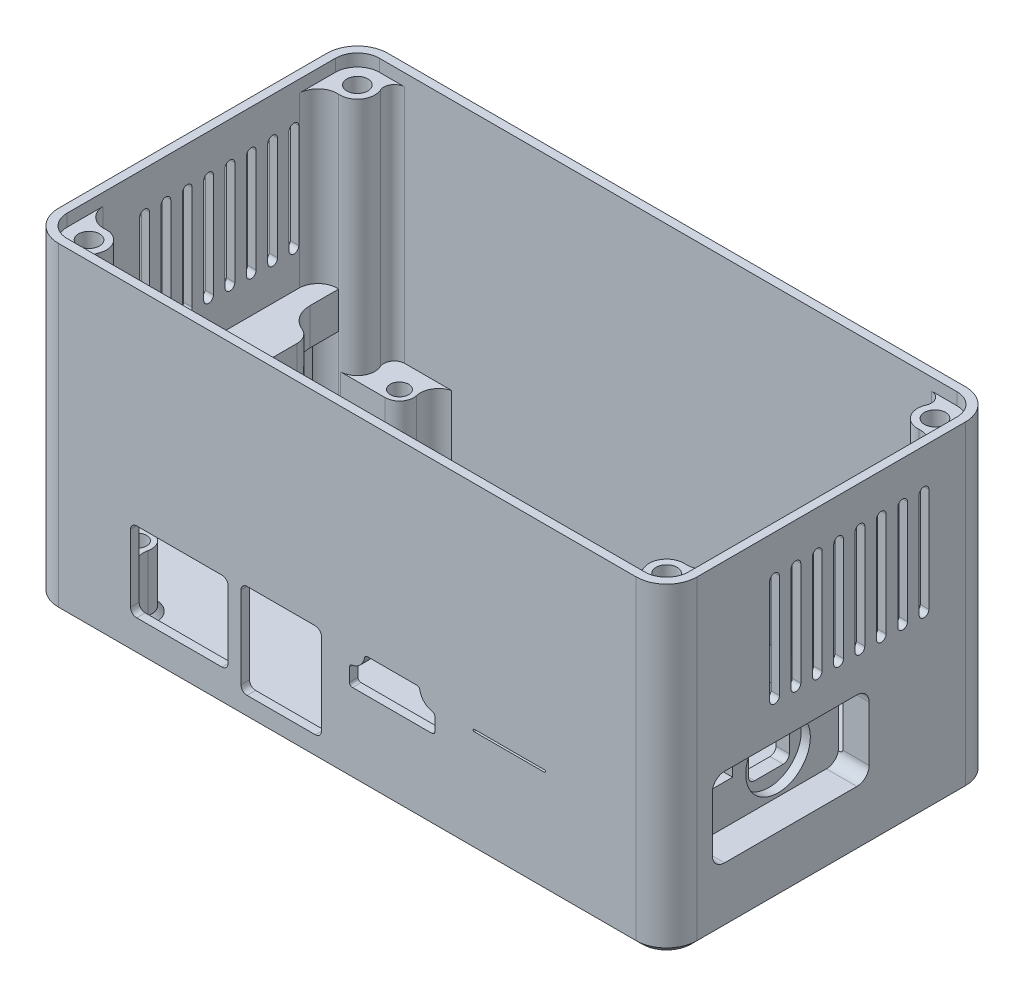
from build123d import *

# Parameters (mm, degrees)
EXTRUDE_1_DEPTH          = 52.66
SHELL_1_T                = -1.4
SKETCH_2_R               = 1.723706828
EXTRUDE_2_DEPTH          = 49.26
MIRROR_2_COPY_1_SKETCH_R = 1.723706828
MIRROR_2_COPY_1_DEPTH    = 49.26
SKETCH_3_R               = 1.5
EXTRUDE_3_DEPTH          = 10
EXTRUDE_4_DEPTH          = 21.6
CUT_EXTRUDE_1_DEPTH      = 15.6
CHAMFER_1_SIZE           = 1
CUT_EXTRUDE_2_DEPTH      = 5
SKETCH_7_R               = 5.3
CUT_EXTRUDE_3_DEPTH      = 1.5
CUT_EXTRUDE_4_DEPTH      = 22
CUT_EXTRUDE_5_REACH      = 93.813
CUT_EXTRUDE_6_REACH      = 122.267
SKETCH_11_R              = 1.723706828
CUT_EXTRUDE_7_DEPTH      = 34
SKETCH_13_R              = 1.5
CUT_EXTRUDE_8_DEPTH      = 10
CHAMFER_2_SIZE           = 3


with BuildPart() as part:
    # 草图1 → 凸台-拉伸1 (new body)
    with BuildSketch(Plane(origin=(0, 0, 0), x_dir=(1, 0, 0), z_dir=(0, 1, 0))):
        with BuildLine():
            Line((47.35, -27), (-47.35, -27))
            ThreePointArc((-47.35, -27), (-50.885533906, -25.535533906), (-52.35, -22))
            Line((-52.35, -22), (-52.35, 22))
            ThreePointArc((-52.35, 22), (-50.885533906, 25.535533906), (-47.35, 27))
            Line((-47.35, 27), (47.35, 27))
            ThreePointArc((47.35, 27), (50.885533906, 25.535533906), (52.35, 22))
            Line((52.35, 22), (52.35, -22))
            ThreePointArc((52.35, -22), (50.885533906, -25.535533906), (47.35, -27))
        make_face()
    extrude(amount=EXTRUDE_1_DEPTH)

    # 抽壳1
    shell_1_openings = [part.faces().sort_by_distance(p)[0] for p in [
        (0, 52.66, 0),
    ]]
    offset(amount=SHELL_1_T, openings=shell_1_openings, kind=Kind.INTERSECTION)

    # 草图2 → 凸台-拉伸2 (add)
    with BuildSketch(Plane(origin=(0, 1.4, 0), x_dir=(1, 0, 0), z_dir=(0, 1, 0))):
        with BuildLine():
            ThreePointArc((-44.739177083, 23.164131527), (-44.61889724, 24.798058128), (-43.190236115, 25.6))
            Line((-43.190236115, 25.6), (-47.35, 25.6))
            ThreePointArc((-47.35, 25.6), (-49.895584412, 24.545584412), (-50.95, 22))
            Line((-50.95, 22), (-50.95, 16.121983226))
            ThreePointArc((-50.95, 16.121983226), (-49.897898243, 18.354900791), (-47.560815859, 19.149183417))
            ThreePointArc((-47.560815859, 19.149183417), (-45.011205321, 20.356333986), (-44.739177083, 23.164131527))
        make_face()
        with Locations(Location((-47.35, 22, 0), (0, 0, 90))):
            Circle(SKETCH_2_R, mode=Mode.SUBTRACT)
    extrude_2 = extrude(amount=EXTRUDE_2_DEPTH)

    # 镜向1: 凸台-拉伸2 across plane
    add(extrude_2.mirror(Plane(origin=(0, 0, 0), x_dir=(0, 0, 1), z_dir=(1, 0, 0))))

    # 镜向2: 凸台-拉伸2 across plane
    add(extrude_2.mirror(Plane.XY))

    # 镜向2 copy 1 sketch → 镜向2 copy 1 (add)
    with BuildSketch(Plane(origin=(0, 1.4, 0), x_dir=(-1, 0, 0), z_dir=(0, 1, 0))):
        with BuildLine():
            ThreePointArc((-44.739177083, 23.164131527), (-44.61889724, 24.798058128), (-43.190236115, 25.6))
            Line((-43.190236115, 25.6), (-47.35, 25.6))
            ThreePointArc((-47.35, 25.6), (-49.895584412, 24.545584412), (-50.95, 22))
            Line((-50.95, 22), (-50.95, 16.121983226))
            ThreePointArc((-50.95, 16.121983226), (-49.897898243, 18.354900791), (-47.560815859, 19.149183417))
            ThreePointArc((-47.560815859, 19.149183417), (-45.011205321, 20.356333986), (-44.739177083, 23.164131527))
        make_face()
        with Locations(Location((-47.35, 22, 0), (0, 0, 90))):
            Circle(MIRROR_2_COPY_1_SKETCH_R, mode=Mode.SUBTRACT)
    extrude(amount=MIRROR_2_COPY_1_DEPTH)

    # 草图3 → 凸台-拉伸3 (add)
    # profile 1 of 4: a face of its own
    with BuildSketch(Plane(origin=(0, 1.4, 0), x_dir=(1, 0, 0), z_dir=(0, 1, 0))):
        with BuildLine():
            ThreePointArc((-44.739177083, 23.164131527), (-44.937413463, 20.466694839), (-47.29547034, 19.141919345))
            Line((-47.29547034, 19.141919345), (-39.925, 19.141919345))
            ThreePointArc((-39.925, 19.141919345), (-38.097072242, 20.025191235), (-37.653200541, 22.006217999))
            ThreePointArc((-37.653200541, 22.006217999), (-37.298713844, 24.245427783), (-35.480787721, 25.6))
            Line((-35.480787721, 25.6), (-43.190236115, 25.6))
            ThreePointArc((-43.190236115, 25.6), (-44.61889724, 24.798058128), (-44.739177083, 23.164131527))
        make_face()
        with Locations(Location((-39.925, 21.475, 0), (0, 0, 270))):
            Circle(SKETCH_3_R, mode=Mode.SUBTRACT)
    # profile 2 of 4: a face of its own
    with BuildSketch(Plane(origin=(0, 1.4, 0), x_dir=(1, 0, 0), z_dir=(0, 1, 0))):
        with BuildLine():
            Line((-43.190236115, -25.6), (-35.480787721, -25.6))
            ThreePointArc((-35.480787721, -25.6), (-37.298713844, -24.245427783), (-37.653200541, -22.006217999))
            ThreePointArc((-37.653200541, -22.006217999), (-38.097072242, -20.025191235), (-39.925, -19.141919345))
            Line((-39.925, -19.141919345), (-47.29547034, -19.141919345))
            ThreePointArc((-47.29547034, -19.141919345), (-44.937413463, -20.466694839), (-44.739177083, -23.164131527))
            ThreePointArc((-44.739177083, -23.164131527), (-44.61889724, -24.798058128), (-43.190236115, -25.6))
        make_face()
        with Locations(Location((-39.925, -21.475, 0), (0, 0, 90))):
            Circle(SKETCH_3_R, mode=Mode.SUBTRACT)
    # profile 3 of 4: a face of its own
    with BuildSketch(Plane(origin=(0, 1.4, 0), x_dir=(1, 0, 0), z_dir=(0, 1, 0))):
        with BuildLine():
            Line((43.190236115, 25.6), (35.480787721, 25.6))
            ThreePointArc((35.480787721, 25.6), (37.298713844, 24.245427783), (37.653200541, 22.006217999))
            ThreePointArc((37.653200541, 22.006217999), (38.097072242, 20.025191235), (39.925, 19.141919345))
            Line((39.925, 19.141919345), (47.29547034, 19.141919345))
            ThreePointArc((47.29547034, 19.141919345), (44.937413463, 20.466694839), (44.739177083, 23.164131527))
            ThreePointArc((44.739177083, 23.164131527), (44.61889724, 24.798058128), (43.190236115, 25.6))
        make_face()
        with Locations(Location((39.925, 21.475, 0), (0, 0, 90))):
            Circle(SKETCH_3_R, mode=Mode.SUBTRACT)
    # profile 4 of 4: a face of its own
    with BuildSketch(Plane(origin=(0, 1.4, 0), x_dir=(1, 0, 0), z_dir=(0, 1, 0))):
        with BuildLine():
            ThreePointArc((44.739177083, -23.164131527), (44.937413463, -20.466694839), (47.29547034, -19.141919345))
            Line((47.29547034, -19.141919345), (39.925, -19.141919345))
            ThreePointArc((39.925, -19.141919345), (38.097072242, -20.025191235), (37.653200541, -22.006217999))
            ThreePointArc((37.653200541, -22.006217999), (37.298713844, -24.245427783), (35.480787721, -25.6))
            Line((35.480787721, -25.6), (43.190236115, -25.6))
            ThreePointArc((43.190236115, -25.6), (44.61889724, -24.798058128), (44.739177083, -23.164131527))
        make_face()
        with Locations(Location((39.925, -21.475, 0), (0, 0, 270))):
            Circle(SKETCH_3_R, mode=Mode.SUBTRACT)
    extrude(amount=EXTRUDE_3_DEPTH)

    # 草图4 → 凸台-拉伸4 (add)
    with BuildSketch(Plane(origin=(0, 1.4, 0), x_dir=(1, 0, 0), z_dir=(0, 1, 0))):
        with BuildLine():
            Line((-47.560815859, 14.421543146), (-47.560815859, 19.149183417))
            ThreePointArc((-47.560815859, 19.149183417), (-49.897898243, 18.354900791), (-50.95, 16.121983226))
            Line((-50.95, 16.121983226), (-50.95, -16.121983226))
            ThreePointArc((-50.95, -16.121983226), (-49.897898243, -18.354900791), (-47.560815859, -19.149183417))
            Line((-47.560815859, -19.149183417), (-47.560815859, -14.421543146))
            ThreePointArc((-47.560815859, -14.421543146), (-46.829898439, -12.029945531), (-44.886897894, -10.45554777))
            ThreePointArc((-44.886897894, -10.45554777), (-43.69744723, -9.491745435), (-43.25, -8.027676174))
            Line((-43.25, -8.027676174), (-43.25, 8.027676174))
            ThreePointArc((-43.25, 8.027676174), (-43.69744723, 9.491745435), (-44.886897894, 10.45554777))
            ThreePointArc((-44.886897894, 10.45554777), (-46.829898439, 12.029945531), (-47.560815859, 14.421543146))
        make_face()
        with BuildLine():
            Line((43.68, 3.500946468), (43.68, -7.623621855))
            ThreePointArc((43.68, -7.623621855), (44.026150119, -8.806383516), (44.955363777, -9.61589388))
            ThreePointArc((44.955363777, -9.61589388), (45.624500178, -10.198830698), (45.873766473, -11.050549649))
            Line((45.873766473, -11.050549649), (45.873766473, -19.141919345))
            Line((45.873766473, -19.141919345), (47.29547034, -19.141919345))
            ThreePointArc((47.29547034, -19.141919345), (47.428227461, -19.142469776), (47.560815859, -19.149183417))
            ThreePointArc((47.560815859, -19.149183417), (49.897898243, -18.354900791), (50.95, -16.121983226))
            Line((50.95, -16.121983226), (50.95, 9.624721853))
            ThreePointArc((50.95, 9.624721853), (49.715635521, 6.971055127), (46.8908207, 6.205533093))
            ThreePointArc((46.8908207, 6.205533093), (44.656385305, 5.600003303), (43.68, 3.500946468))
        make_face()
    extrude(amount=EXTRUDE_4_DEPTH)

    # 草图5 → 切除-拉伸1 (cut)
    with BuildSketch(Plane(origin=(0, 1.4, 0), x_dir=(1, 0, 0), z_dir=(0, 1, 0))):
        with BuildLine():
            Line((-50.45, 17.708343317), (-50.45, -17.708343317))
            ThreePointArc((-50.45, -17.708343317), (-49.203403602, -18.825785879), (-47.560815859, -19.149183417))
            Line((-47.560815859, -19.149183417), (-47.560815859, -14.421543146))
            ThreePointArc((-47.560815859, -14.421543146), (-46.829898439, -12.029945531), (-44.886897894, -10.45554777))
            ThreePointArc((-44.886897894, -10.45554777), (-43.69744723, -9.491745435), (-43.25, -8.027676174))
            Line((-43.25, -8.027676174), (-43.25, 8.027676174))
            ThreePointArc((-43.25, 8.027676174), (-43.69744723, 9.491745435), (-44.886897894, 10.45554777))
            ThreePointArc((-44.886897894, 10.45554777), (-46.829898439, 12.029945531), (-47.560815859, 14.421543146))
            Line((-47.560815859, 14.421543146), (-47.560815859, 19.149183417))
            ThreePointArc((-47.560815859, 19.149183417), (-49.203403602, 18.825785879), (-50.45, 17.708343317))
        make_face()
    extrude(amount=CUT_EXTRUDE_1_DEPTH, mode=Mode.SUBTRACT)

    # 倒角1
    chamfer_1_edges = [part.edges().sort_by_distance(p)[0] for p in [
        (0, 0, -27),
        (50.885533906, 0, -25.535533906),
        (52.35, 0, 0),
        (50.885533906, 0, 25.535533906),
        (0, 0, 27),
        (-50.885533906, 0, 25.535533906),
        (-52.35, 0, 0),
        (-50.885533906, 0, -25.535533906),
    ]]
    chamfer(chamfer_1_edges, length=CHAMFER_1_SIZE)

    # 草图6 → 切除-拉伸2 (cut)
    with BuildSketch(Plane(origin=(52.35, 0, 0), x_dir=(0, 0, -1), z_dir=(1, 0, 0))):
        with BuildLine():
            Line((4.2, 9.8), (-17.5, 9.8))
            ThreePointArc((-17.5, 9.8), (-18.914213562, 10.385786438), (-19.5, 11.8))
            Line((-19.5, 11.8), (-19.5, 20.8))
            ThreePointArc((-19.5, 20.8), (-18.914213562, 22.214213562), (-17.5, 22.8))
            Line((-17.5, 22.8), (4.2, 22.8))
            ThreePointArc((4.2, 22.8), (5.614213562, 22.214213562), (6.2, 20.8))
            Line((6.2, 20.8), (6.2, 11.8))
            ThreePointArc((6.2, 11.8), (5.614213562, 10.385786438), (4.2, 9.8))
        make_face()
    extrude(amount=-CUT_EXTRUDE_2_DEPTH, mode=Mode.SUBTRACT)

    # 草图7 → 切除-拉伸3 (cut)
    with BuildSketch(Plane(origin=(47.35, 0, 0), x_dir=(0, 0, -1), z_dir=(1, 0, 0))):
        with Locations((-3.73, 15.65)):
            Circle(SKETCH_7_R)
        Polygon((-17.8, 16.3), (-11.18, 16.3), (-11.18, 17.78), (-12.58, 18.6), (-16.4, 18.6), (-17.8, 17.78), align=None)
    extrude(amount=-CUT_EXTRUDE_3_DEPTH, mode=Mode.SUBTRACT)

    # 草图8 → 切除-拉伸4 (cut)
    with BuildSketch(Plane(origin=(45.85, 0, 0), x_dir=(0, 0, -1), z_dir=(1, 0, 0))):
        with BuildLine():
            Line((-6.08, 18.8), (-1.38, 18.8))
            ThreePointArc((-1.38, 18.8), (-0.672893219, 18.507106781), (-0.38, 17.8))
            Line((-0.38, 17.8), (-0.38, 13.5))
            ThreePointArc((-0.38, 13.5), (-0.672893219, 12.792893219), (-1.38, 12.5))
            Line((-1.38, 12.5), (-6.08, 12.5))
            ThreePointArc((-6.08, 12.5), (-6.787106781, 12.792893219), (-7.08, 13.5))
            Line((-7.08, 13.5), (-7.08, 17.8))
            ThreePointArc((-7.08, 17.8), (-6.787106781, 18.507106781), (-6.08, 18.8))
        make_face()
    extrude(amount=-CUT_EXTRUDE_4_DEPTH, mode=Mode.SUBTRACT)

    # 草图9 → 切除-拉伸5 (cut, up to next)
    with BuildSketch(Plane.XY.offset(27), mode=Mode.PRIVATE) as cut_extrude_5_sk1:
        with BuildLine():
            Line((-34.55, 18.95), (-20.55, 18.95))
            ThreePointArc((-20.55, 18.95), (-19.842893219, 18.657106781), (-19.55, 17.95))
            Line((-19.55, 17.95), (-19.55, 6.9))
            ThreePointArc((-19.55, 6.9), (-19.842893219, 6.192893219), (-20.55, 5.9))
            Line((-20.55, 5.9), (-34.55, 5.9))
            ThreePointArc((-34.55, 5.9), (-35.257106781, 6.192893219), (-35.55, 6.9))
            Line((-35.55, 6.9), (-35.55, 17.95))
            ThreePointArc((-35.55, 17.95), (-35.257106781, 18.657106781), (-34.55, 18.95))
        make_face()
    cut_extrude_5_tool1 = extrude(cut_extrude_5_sk1.sketch, amount=-CUT_EXTRUDE_5_REACH, mode=Mode.PRIVATE) & part.part
    # 草图9 → 切除-拉伸5 (cut, up to next)
    with BuildSketch(Plane.XY.offset(27), mode=Mode.PRIVATE) as cut_extrude_5_sk2:
        with BuildLine():
            ThreePointArc((-17.44, 18.41), (-17.147106781, 19.117106781), (-16.44, 19.41))
            Line((-16.44, 19.41), (-5.25, 19.41))
            ThreePointArc((-5.25, 19.41), (-4.542893219, 19.117106781), (-4.25, 18.41))
            Line((-4.25, 18.41), (-4.25, 4.94))
            ThreePointArc((-4.25, 4.94), (-4.542893219, 4.232893219), (-5.25, 3.94))
            Line((-5.25, 3.94), (-16.44, 3.94))
            ThreePointArc((-16.44, 3.94), (-17.147106781, 4.232893219), (-17.44, 4.94))
            Line((-17.44, 4.94), (-17.44, 18.41))
        make_face()
    cut_extrude_5_tool2 = extrude(cut_extrude_5_sk2.sketch, amount=-CUT_EXTRUDE_5_REACH, mode=Mode.PRIVATE) & part.part
    # 草图9 → 切除-拉伸5 (cut, up to next)
    with BuildSketch(Plane.XY.offset(27), mode=Mode.PRIVATE) as cut_extrude_5_sk3:
        with BuildLine():
            ThreePointArc((2.815033243, 18.883333333), (2.985291279, 19.181881308), (3.308039892, 19.3))
            Line((3.308039892, 19.3), (11.391960108, 19.3))
            ThreePointArc((11.391960108, 19.3), (11.714708721, 19.181881308), (11.884966757, 18.883333333))
            ThreePointArc((11.884966757, 18.883333333), (12.582233047, 17.532233047), (13.933333333, 16.834966757))
            ThreePointArc((13.933333333, 16.834966757), (14.231881308, 16.664708721), (14.35, 16.341960108))
            Line((14.35, 16.341960108), (14.35, 14.2))
            ThreePointArc((14.35, 14.2), (14.203553391, 13.846446609), (13.85, 13.7))
            Line((13.85, 13.7), (0.85, 13.7))
            ThreePointArc((0.85, 13.7), (0.496446609, 13.846446609), (0.35, 14.2))
            Line((0.35, 14.2), (0.35, 16.341960108))
            ThreePointArc((0.35, 16.341960108), (0.468118692, 16.664708721), (0.766666667, 16.834966757))
            ThreePointArc((0.766666667, 16.834966757), (2.117766953, 17.532233047), (2.815033243, 18.883333333))
        make_face()
    cut_extrude_5_tool3 = extrude(cut_extrude_5_sk3.sketch, amount=-CUT_EXTRUDE_5_REACH, mode=Mode.PRIVATE) & part.part
    # 草图9 → 切除-拉伸5 (cut, up to next)
    with BuildSketch(Plane.XY.offset(27), mode=Mode.PRIVATE) as cut_extrude_5_sk4:
        with BuildLine():
            Line((20.811684673, 17.4), (32.311684673, 17.4))
            ThreePointArc((32.311684673, 17.4), (32.486684673, 17.575), (32.311684673, 17.75))
            Line((32.311684673, 17.75), (20.811684673, 17.75))
            ThreePointArc((20.811684673, 17.75), (20.636684673, 17.575), (20.811684673, 17.4))
        make_face()
    cut_extrude_5_tool4 = extrude(cut_extrude_5_sk4.sketch, amount=-CUT_EXTRUDE_5_REACH, mode=Mode.PRIVATE) & part.part
    add(cut_extrude_5_tool1.solids().sort_by_distance((-27.55, 12.425, 27))[0], mode=Mode.SUBTRACT)
    add(cut_extrude_5_tool2.solids().sort_by_distance((-10.845, 11.675, 27))[0], mode=Mode.SUBTRACT)
    add(cut_extrude_5_tool3.solids().sort_by_distance((7.35, 16.250832, 27))[0], mode=Mode.SUBTRACT)
    add(cut_extrude_5_tool4.solids().sort_by_distance((26.561685, 17.575, 27))[0], mode=Mode.SUBTRACT)

    # 草图10 → 切除-拉伸6 (cut, up to next)
    with BuildSketch(Plane.ZY.offset(52.35), mode=Mode.PRIVATE) as cut_extrude_6_sk1:
        with BuildLine():
            Line((-14.4, 46.06), (-14.4, 29.06))
            ThreePointArc((-14.4, 29.06), (-15.2, 28.26), (-16, 29.06))
            Line((-16, 29.06), (-16, 46.06))
            ThreePointArc((-16, 46.06), (-15.2, 46.86), (-14.4, 46.06))
        make_face()
    cut_extrude_6_tool1 = extrude(cut_extrude_6_sk1.sketch, amount=-CUT_EXTRUDE_6_REACH, mode=Mode.PRIVATE) & part.part
    # 草图10 → 切除-拉伸6 (cut, up to next)
    with BuildSketch(Plane.ZY.offset(52.35), mode=Mode.PRIVATE) as cut_extrude_6_sk2:
        with BuildLine():
            Line((-10.9, 46.06), (-10.9, 29.06))
            ThreePointArc((-10.9, 29.06), (-11.7, 28.26), (-12.5, 29.06))
            Line((-12.5, 29.06), (-12.5, 46.06))
            ThreePointArc((-12.5, 46.06), (-11.7, 46.86), (-10.9, 46.06))
        make_face()
    cut_extrude_6_tool2 = extrude(cut_extrude_6_sk2.sketch, amount=-CUT_EXTRUDE_6_REACH, mode=Mode.PRIVATE) & part.part
    # 草图10 → 切除-拉伸6 (cut, up to next)
    with BuildSketch(Plane.ZY.offset(52.35), mode=Mode.PRIVATE) as cut_extrude_6_sk3:
        with BuildLine():
            Line((-7.4, 46.06), (-7.4, 29.06))
            ThreePointArc((-7.4, 29.06), (-8.2, 28.26), (-9, 29.06))
            Line((-9, 29.06), (-9, 46.06))
            ThreePointArc((-9, 46.06), (-8.2, 46.86), (-7.4, 46.06))
        make_face()
    cut_extrude_6_tool3 = extrude(cut_extrude_6_sk3.sketch, amount=-CUT_EXTRUDE_6_REACH, mode=Mode.PRIVATE) & part.part
    # 草图10 → 切除-拉伸6 (cut, up to next)
    with BuildSketch(Plane.ZY.offset(52.35), mode=Mode.PRIVATE) as cut_extrude_6_sk4:
        with BuildLine():
            Line((-3.9, 46.06), (-3.9, 29.06))
            ThreePointArc((-3.9, 29.06), (-4.7, 28.26), (-5.5, 29.06))
            Line((-5.5, 29.06), (-5.5, 46.06))
            ThreePointArc((-5.5, 46.06), (-4.7, 46.86), (-3.9, 46.06))
        make_face()
    cut_extrude_6_tool4 = extrude(cut_extrude_6_sk4.sketch, amount=-CUT_EXTRUDE_6_REACH, mode=Mode.PRIVATE) & part.part
    # 草图10 → 切除-拉伸6 (cut, up to next)
    with BuildSketch(Plane.ZY.offset(52.35), mode=Mode.PRIVATE) as cut_extrude_6_sk5:
        with BuildLine():
            Line((-0.4, 46.06), (-0.4, 29.06))
            ThreePointArc((-0.4, 29.06), (-1.2, 28.26), (-2, 29.06))
            Line((-2, 29.06), (-2, 46.06))
            ThreePointArc((-2, 46.06), (-1.2, 46.86), (-0.4, 46.06))
        make_face()
    cut_extrude_6_tool5 = extrude(cut_extrude_6_sk5.sketch, amount=-CUT_EXTRUDE_6_REACH, mode=Mode.PRIVATE) & part.part
    # 草图10 → 切除-拉伸6 (cut, up to next)
    with BuildSketch(Plane.ZY.offset(52.35), mode=Mode.PRIVATE) as cut_extrude_6_sk6:
        with BuildLine():
            Line((3.1, 46.06), (3.1, 29.06))
            ThreePointArc((3.1, 29.06), (2.3, 28.26), (1.5, 29.06))
            Line((1.5, 29.06), (1.5, 46.06))
            ThreePointArc((1.5, 46.06), (2.3, 46.86), (3.1, 46.06))
        make_face()
    cut_extrude_6_tool6 = extrude(cut_extrude_6_sk6.sketch, amount=-CUT_EXTRUDE_6_REACH, mode=Mode.PRIVATE) & part.part
    # 草图10 → 切除-拉伸6 (cut, up to next)
    with BuildSketch(Plane.ZY.offset(52.35), mode=Mode.PRIVATE) as cut_extrude_6_sk7:
        with BuildLine():
            Line((6.6, 46.06), (6.6, 29.06))
            ThreePointArc((6.6, 29.06), (5.8, 28.26), (5, 29.06))
            Line((5, 29.06), (5, 46.06))
            ThreePointArc((5, 46.06), (5.8, 46.86), (6.6, 46.06))
        make_face()
    cut_extrude_6_tool7 = extrude(cut_extrude_6_sk7.sketch, amount=-CUT_EXTRUDE_6_REACH, mode=Mode.PRIVATE) & part.part
    # 草图10 → 切除-拉伸6 (cut, up to next)
    with BuildSketch(Plane.ZY.offset(52.35), mode=Mode.PRIVATE) as cut_extrude_6_sk8:
        with BuildLine():
            Line((10.1, 46.06), (10.1, 29.06))
            ThreePointArc((10.1, 29.06), (9.3, 28.26), (8.5, 29.06))
            Line((8.5, 29.06), (8.5, 46.06))
            ThreePointArc((8.5, 46.06), (9.3, 46.86), (10.1, 46.06))
        make_face()
    cut_extrude_6_tool8 = extrude(cut_extrude_6_sk8.sketch, amount=-CUT_EXTRUDE_6_REACH, mode=Mode.PRIVATE) & part.part
    cut_extrude_6_1 = cut_extrude_6_tool1.solids().sort_by_distance((-52.35, 37.56, -15.2))[0]
    add(cut_extrude_6_1, mode=Mode.SUBTRACT)
    cut_extrude_6_2 = cut_extrude_6_tool2.solids().sort_by_distance((-52.35, 37.56, -11.7))[0]
    add(cut_extrude_6_2, mode=Mode.SUBTRACT)
    cut_extrude_6_3 = cut_extrude_6_tool3.solids().sort_by_distance((-52.35, 37.56, -8.2))[0]
    add(cut_extrude_6_3, mode=Mode.SUBTRACT)
    cut_extrude_6_4 = cut_extrude_6_tool4.solids().sort_by_distance((-52.35, 37.56, -4.7))[0]
    add(cut_extrude_6_4, mode=Mode.SUBTRACT)
    cut_extrude_6_5 = cut_extrude_6_tool5.solids().sort_by_distance((-52.35, 37.56, -1.2))[0]
    add(cut_extrude_6_5, mode=Mode.SUBTRACT)
    cut_extrude_6_6 = cut_extrude_6_tool6.solids().sort_by_distance((-52.35, 37.56, 2.3))[0]
    add(cut_extrude_6_6, mode=Mode.SUBTRACT)
    cut_extrude_6_7 = cut_extrude_6_tool7.solids().sort_by_distance((-52.35, 37.56, 5.8))[0]
    add(cut_extrude_6_7, mode=Mode.SUBTRACT)
    cut_extrude_6_8 = cut_extrude_6_tool8.solids().sort_by_distance((-52.35, 37.56, 9.3))[0]
    add(cut_extrude_6_8, mode=Mode.SUBTRACT)
    cut_extrude_6 = cut_extrude_6_1 + cut_extrude_6_2 + cut_extrude_6_3 + cut_extrude_6_4 + cut_extrude_6_5 + cut_extrude_6_6 + cut_extrude_6_7 + cut_extrude_6_8  # 切除-拉伸6 as one shape, for the pattern or mirror that repeats it

    # 镜向3: 切除-拉伸6 across plane
    add(cut_extrude_6.mirror(Plane(origin=(0, 0, 0), x_dir=(0, 0, 1), z_dir=(1, 0, 0))), mode=Mode.SUBTRACT)

    # 草图11 → 切除-拉伸7 (cut)
    with BuildSketch(Plane(origin=(0, 0, 0), x_dir=(1, 0, 0), z_dir=(0, 1, 0))):
        with Locations(Location((-47.35, 22, 0), (0, 0, 90))):
            Circle(SKETCH_11_R)
        with Locations(Location((47.35, 22, 0), (0, 0, 90))):
            Circle(SKETCH_11_R)
        with Locations(Location((47.35, -22, 0), (0, 0, 90))):
            Circle(SKETCH_11_R)
        with Locations(Location((-47.35, -22, 0), (0, 0, 90))):
            Circle(SKETCH_11_R)
    extrude(amount=CUT_EXTRUDE_7_DEPTH, mode=Mode.SUBTRACT)

    # 草图13 → 切除-拉伸8 (cut)
    with BuildSketch(Plane(origin=(0, 0, 0), x_dir=(1, 0, 0), z_dir=(0, 1, 0))):
        with Locations(Location((-39.925, 21.475, 0), (0, 0, 270))):
            Circle(SKETCH_13_R)
        with Locations(Location((39.925, 21.475, 0), (0, 0, 270))):
            Circle(SKETCH_13_R)
        with Locations(Location((39.925, -21.475, 0), (0, 0, 270))):
            Circle(SKETCH_13_R)
        with Locations(Location((-39.925, -21.475, 0), (0, 0, 270))):
            Circle(SKETCH_13_R)
    extrude(amount=CUT_EXTRUDE_8_DEPTH, mode=Mode.SUBTRACT)

    # 倒角2
    chamfer_2_edges = [part.edges().sort_by_distance(p)[0] for p in [
        (-39.925, 0, 19.975),
        (39.925, 0, 19.975),
        (39.925, 0, -22.975),
        (-39.925, 0, -22.975),
    ]]
    chamfer(chamfer_2_edges, length=CHAMFER_2_SIZE)


solid = part.part
